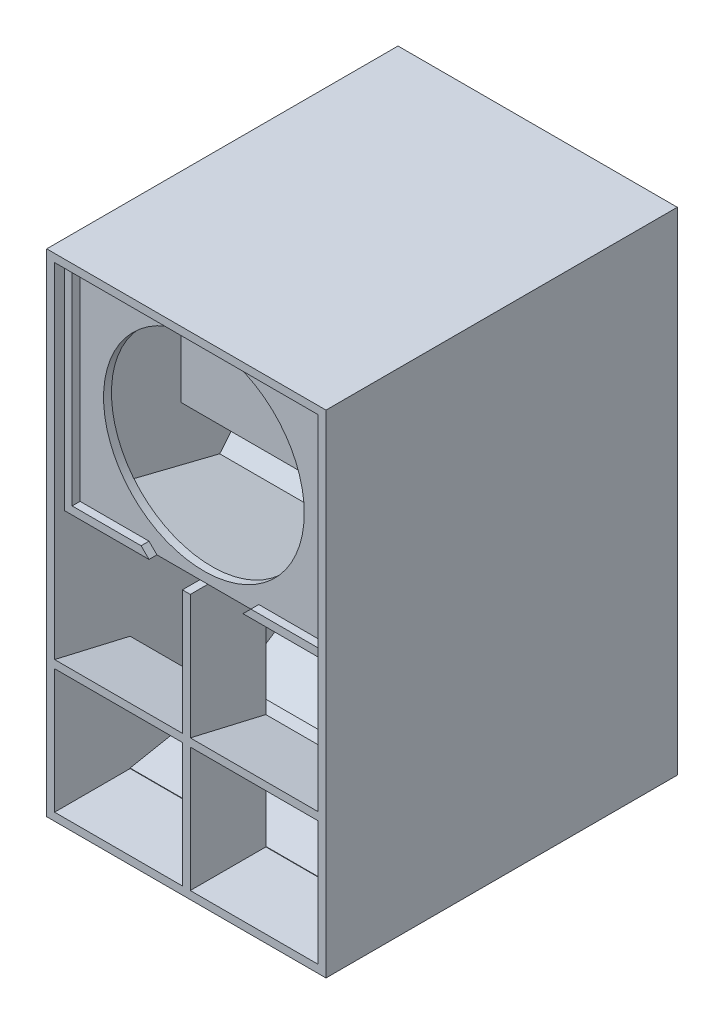
from build123d import *

# Parameters (mm, degrees)
SKETCH1_W           = 636
SKETCH1_H           = 800
BOSS_EXTRUDE1_DEPTH = 18
BOSS_EXTRUDE2_DEPTH = 636
SKETCH4_W           = 636
SKETCH4_H           = 18
BOSS_EXTRUDE3_DEPTH = 1084
SKETCH5_W           = 636
SKETCH5_H           = 800
BOSS_EXTRUDE4_DEPTH = 18
BOSS_EXTRUDE6_DEPTH = 18
SKETCH11_W          = 18
SKETCH11_H          = 800
BOSS_EXTRUDE7_DEPTH = 1084
SKETCH13_W          = 636
SKETCH13_H          = 18
SKETCH15_W          = 18
SKETCH15_H          = 800
BOSS_EXTRUDE8_DEPTH = 1084
SKETCH16_R          = 228.5
CUT_EXTRUDE1_DEPTH  = 18.1
SKETCH17_W          = 18
SKETCH17_H          = 18
BOSS_EXTRUDE9_DEPTH = 18


with BuildPart() as part:
    # Sketch1 → Boss-Extrude1 (new body)
    with BuildSketch(Plane(origin=(0, 0, 0), x_dir=(1, 0, 0), z_dir=(0, 1, 0))):
        Rectangle(SKETCH1_W, SKETCH1_H)
    extrude(amount=BOSS_EXTRUDE1_DEPTH)

    # Sketch3 → Boss-Extrude2 (add)
    with BuildSketch(Plane.ZY.offset(318)):
        Polygon((139.336620479, 18), (228, 18), (228, 19.102485389), (-15, 66.336900509), (-219, 199.336900509), (-339.866628021, 382), (-382, 613.733545883), (-382, 547), (-352, 382), (-219, 181), (-15, 48), align=None)
        Polygon((360, 602), (360, 1102), (342, 1102), (342, 616.063141277), (24.044559613, 536.787946332), (-78.801457937, 659.355057231), (-101.379606002, 874.171786631), (-119.281000119, 872.290274292), (-96.127616004, 652.00053947), (4.612607271, 531.943016464), (17.485608625, 516.601570853), (342, 597.512095949), align=None)
        Polygon((112, 682), (112, 1102), (94, 1102), (94, 995.153242294), (2.678735209, 1102), (-21, 1102), (94, 967.448894468), (94, 682), align=None)
        Polygon((-226, 1102), (-253.559600781, 1102), (-382, 991.219245449), (-382, 967.448894468), align=None)
    extrude(amount=-BOSS_EXTRUDE2_DEPTH)


with BuildPart() as boss_extrude2_piece_1:
    # of the separate pieces the step leaves, piece 1, a body of its own (boss_extrude2_pieces)
    add(part.part.solids().sort_by_distance((-318, 0, 400))[0])



with BuildPart() as boss_extrude2_piece_2:
    # of the separate pieces the step leaves, piece 2, a body of its own (boss_extrude2_pieces)
    add(part.part.solids().sort_by_distance((-318, 602, 360))[0])


with BuildPart() as boss_extrude2_piece_3:
    # of the separate pieces the step leaves, piece 3, a body of its own (boss_extrude2_pieces)
    add(part.part.solids().sort_by_distance((-318, 682, 112))[0])


with BuildPart() as boss_extrude2_piece_4:
    # of the separate pieces the step leaves, piece 4, a body of its own (boss_extrude2_pieces)
    add(part.part.solids().sort_by_distance((-318, 1102, -226))[0])


with BuildPart() as boss_extrude2_piece_1_1:
    add(boss_extrude2_piece_1.part)

    add(boss_extrude2_piece_4.part)  # Boss-Extrude3 merges Boss-Extrude2 piece 4
    # Sketch4 → Boss-Extrude3 (add)
    with BuildSketch(Plane(origin=(0, 18, 0), x_dir=(1, 0, 0), z_dir=(0, 1, 0))):
        with Locations((0, 391)):
            Rectangle(SKETCH4_W, SKETCH4_H)
    extrude(amount=BOSS_EXTRUDE3_DEPTH)


    add(boss_extrude2_piece_2.part)  # Boss-Extrude4 merges Boss-Extrude2 piece 2

    add(boss_extrude2_piece_3.part)  # Boss-Extrude4 merges Boss-Extrude2 piece 3
    # Sketch5 → Boss-Extrude4 (add)
    with BuildSketch(Plane(origin=(0, 1102, 0), x_dir=(1, 0, 0), z_dir=(0, 1, 0))):
        Rectangle(SKETCH5_W, SKETCH5_H)
    extrude(amount=BOSS_EXTRUDE4_DEPTH)

    # Sketch10 → Boss-Extrude6 (add)
    with BuildSketch(Plane.ZY.offset(9)):
        Polygon((400, 18), (228, 18), (228, 569.088703625), (360, 602), (400, 602), align=None)
    extrude(amount=-BOSS_EXTRUDE6_DEPTH)

    # Sketch11 → Boss-Extrude7 (add)
    with BuildSketch(Plane(origin=(0, 18, 0), x_dir=(1, 0, 0), z_dir=(0, 1, 0))):
        with Locations((309, 0)):
            Rectangle(SKETCH11_W, SKETCH11_H)
    extrude(amount=BOSS_EXTRUDE7_DEPTH)

    # Sweep1: sweep along a path in Sketch14
    with BuildLine(Plane.ZY.offset(9)) as sweep1_path:
        Line((228, 261), (400, 301))
    # Sketch13 → Sweep1 (sweep)
    with BuildSketch(Plane(origin=(0, 0, 228), x_dir=(-1, 0, 0), z_dir=(0, 0, -1))):
        with Locations((0, 270)):
            Rectangle(SKETCH13_W, SKETCH13_H)
    sweep(path=sweep1_path.line)

    # Sketch15 → Boss-Extrude8 (add)
    with BuildSketch(Plane(origin=(0, 18, 0), x_dir=(1, 0, 0), z_dir=(0, 1, 0))):
        with Locations((-309, 0)):
            Rectangle(SKETCH15_W, SKETCH15_H)
    extrude(amount=BOSS_EXTRUDE8_DEPTH)

    # Sketch16 → Cut-Extrude1 (cut)
    with BuildSketch(Plane.XY.offset(360)):
        with Locations((0, 852)):
            Circle(SKETCH16_R)
    extrude(amount=-CUT_EXTRUDE1_DEPTH, mode=Mode.SUBTRACT)

    # Sketch17 → Boss-Extrude9 (add)
    with BuildSketch(Plane.XY.offset(360)):
        Polygon((300, 1102), (107, 1102), (125, 1084), (282, 1084), (282, 620), (300, 620), align=None)
        Polygon((-282, 620), (-282, 1084), (-125, 1084), (-107, 1102), (-300, 1102), (-300, 1084), (-300, 602), (-107, 602), (-125, 620), align=None)
        with Locations((291, 611)):
            Rectangle(SKETCH17_W, SKETCH17_H)
        Polygon((282, 602), (282, 620), (125, 620), (107, 602), align=None)
    extrude(amount=BOSS_EXTRUDE9_DEPTH)


solid = boss_extrude2_piece_1_1.part
